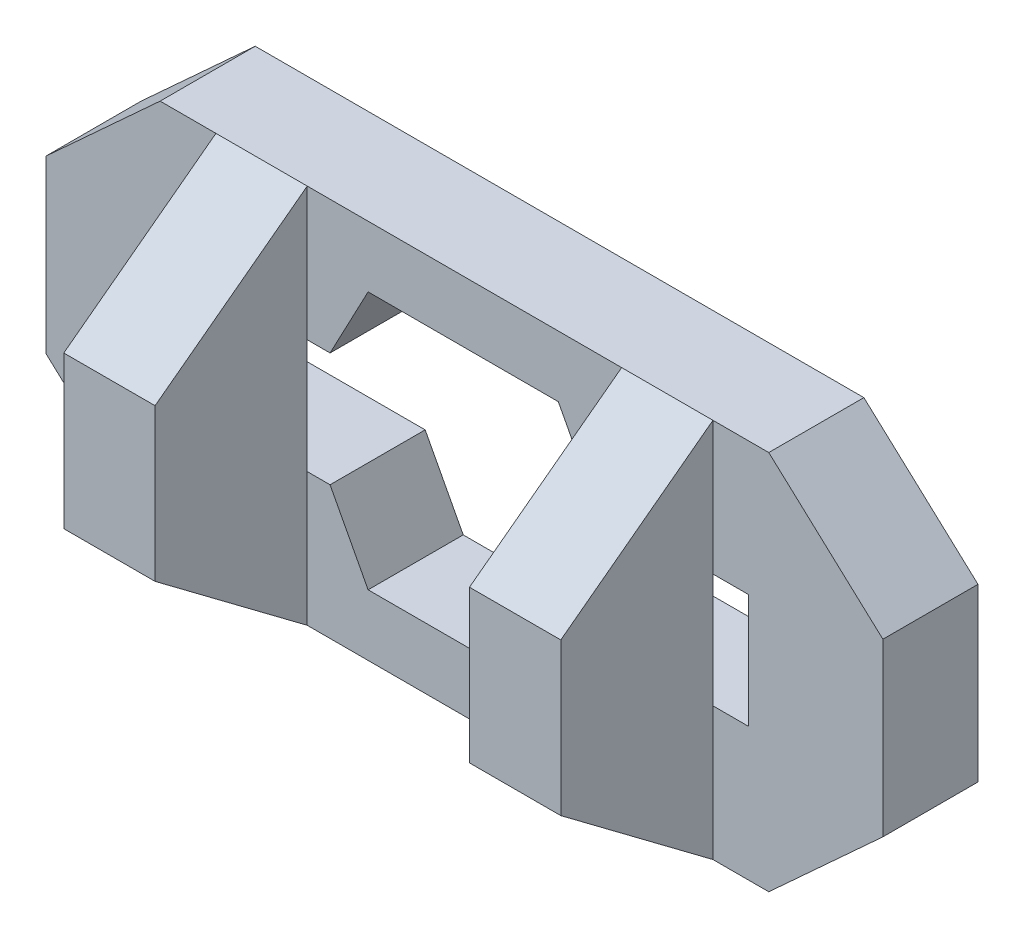
from build123d import *

# Parameters (mm, degrees)
EXTRUDE1_DEPTH = 25


with BuildPart() as part:
    # Sketch1 → Extrude1 (new body)
    with BuildSketch(Plane.XY):
        Polygon((110, 22.5), (110, -22.5), (80, -50), (-80, -50), (-110, -22.5), (-110, 22.5), (-80, 50), (80, 50), align=None)
        Polygon((-75.325078699, 15), (-35.325078699, 15), (-25.325078699, 33.914218403), (24.674921301, 33.914218403), (34.674921301, 15), (74.674921301, 15), (74.674921301, -15), (34.674921301, -15), (24.674921301, -33.914218403), (-25.325078699, -33.914218403), (-35.325078699, -15), (-75.325078699, -15), align=None, mode=Mode.SUBTRACT)
    extrude(amount=EXTRUDE1_DEPTH)

    # Sketch3 → Loft1 section 0
    with BuildSketch(Plane.XY.offset(25)):
        with BuildLine():
            Line((-65.325078699, -50), (-41.325078699, -50))
            Line((-41.325078699, -50), (-41.325078699, 50))
            Line((-41.325078699, 50), (-65.325078699, 50))
            Line((-65.325078699, 50), (-65.325078699, -50))
        make_face()
    # Sketch2 → Loft1 section 1
    with BuildSketch(Plane.XY.offset(65)):
        with BuildLine():
            Line((-65.325078699, 20), (-41.325078699, 20))
            Line((-41.325078699, 20), (-41.325078699, -20))
            Line((-41.325078699, -20), (-65.325078699, -20))
            Line((-65.325078699, -20), (-65.325078699, 20))
        make_face()
    loft1 = loft()

    # Mirror1: Loft1 across plane
    add(loft1.mirror(Plane(origin=(0, 0, 0), x_dir=(0, 0, 1), z_dir=(1, 0, 0))))


solid = part.part
